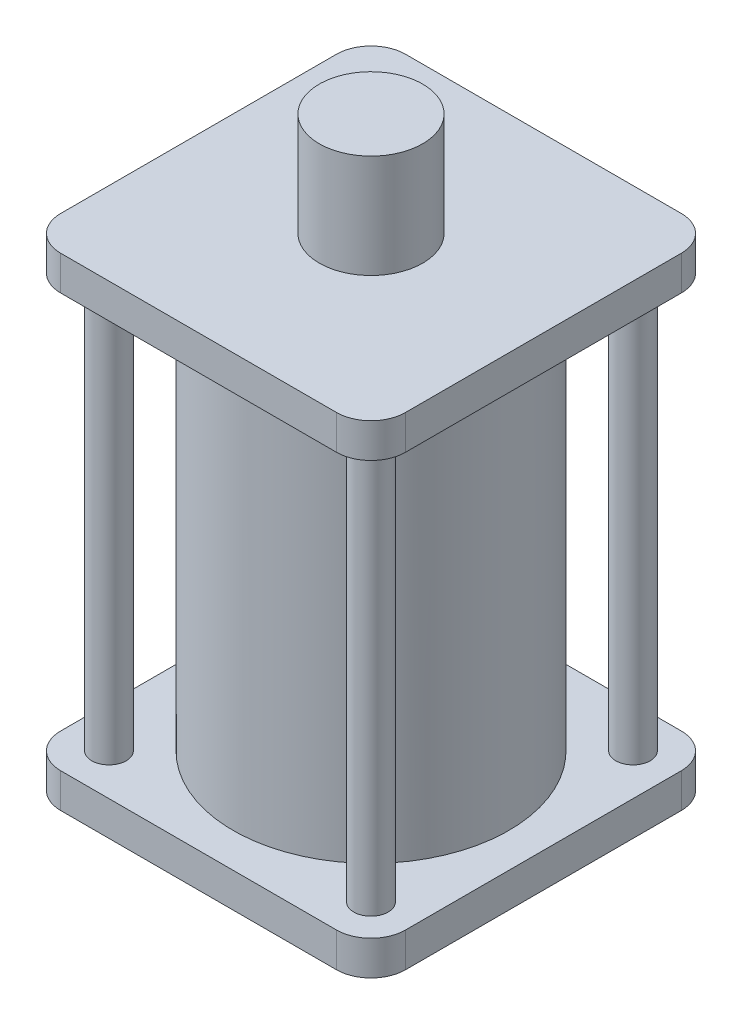
from build123d import *

# Parameters (mm, degrees)
SKETCH1_W           = 100
SKETCH1_H           = 100
BOSS_EXTRUDE1_DEPTH = 10
SKETCH2_R           = 40
BOSS_EXTRUDE2_DEPTH = 120
SKETCH3_W           = 100
SKETCH3_H           = 100
BOSS_EXTRUDE3_DEPTH = 10
SKETCH4_R           = 15
BOSS_EXTRUDE4_DEPTH = 30
SKETCH5_R           = 5
BOSS_EXTRUDE5_DEPTH = 120
FILLET1_R           = 10


with BuildPart() as part:
    # Sketch1 → Boss-Extrude1 (new body)
    with BuildSketch(Plane(origin=(0, 0, 0), x_dir=(1, 0, 0), z_dir=(0, 1, 0))):
        Rectangle(SKETCH1_W, SKETCH1_H)
    extrude(amount=BOSS_EXTRUDE1_DEPTH)



with BuildPart() as body_2:
    # Sketch2 → Boss-Extrude2 (new body)
    with BuildSketch(Plane(origin=(0, 10, 0), x_dir=(1, 0, 0), z_dir=(0, 1, 0))):
        with Locations(Location((0, 0, 0), (0, 0, 270))):
            Circle(SKETCH2_R)
    extrude(amount=BOSS_EXTRUDE2_DEPTH)


with BuildPart() as body_3:
    # Sketch3 → Boss-Extrude3 (new body)
    with BuildSketch(Plane(origin=(0, 130, 0), x_dir=(1, 0, 0), z_dir=(0, 1, 0))):
        Rectangle(SKETCH3_W, SKETCH3_H)
    extrude(amount=BOSS_EXTRUDE3_DEPTH)


with BuildPart() as body_4:
    # Sketch4 → Boss-Extrude4 (new body)
    with BuildSketch(Plane(origin=(0, 140, 0), x_dir=(1, 0, 0), z_dir=(0, 1, 0))):
        with Locations(Location((0, 0, 0), (0, 0, 270))):
            Circle(SKETCH4_R)
    extrude(amount=BOSS_EXTRUDE4_DEPTH)


with BuildPart() as part_1:
    add(part.part)

    add(body_2.part)  # Boss-Extrude5 merges body 2

    add(body_3.part)  # Boss-Extrude5 merges body 3
    # Sketch5 → Boss-Extrude5 (add)
    with BuildSketch(Plane(origin=(0, 10, 0), x_dir=(1, 0, 0), z_dir=(0, 1, 0))):
        with Locations(Location((-38, 38, 0), (0, 0, 90))):
            Circle(SKETCH5_R)
        with Locations(Location((38, 38, 0), (0, 0, 90))):
            Circle(SKETCH5_R)
        with Locations(Location((38, -38, 0), (0, 0, 90))):
            Circle(SKETCH5_R)
        with Locations(Location((-38, -38, 0), (0, 0, 90))):
            Circle(SKETCH5_R)
    extrude(amount=BOSS_EXTRUDE5_DEPTH)

    # Fillet1
    fillet1_edges = [part_1.edges().sort_by_distance(p)[0] for p in [
        (-50, 135, -50),
        (-50, 135, 50),
        (50, 135, 50),
        (50, 135, -50),
        (50, 5, 50),
        (-50, 5, 50),
        (-50, 5, -50),
        (50, 5, -50),
    ]]
    fillet(fillet1_edges, radius=FILLET1_R)


solid = Compound([body_4.part, part_1.part])
